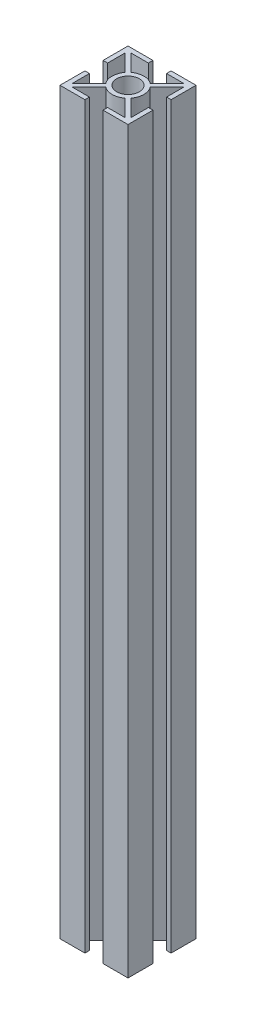
from build123d import *

# Parameters (mm, degrees)
SKETCH1_R               = 5
BOSS_EXTRUDE1_DEPTH     = 326
CUT_EXTRUDE1_REACH      = 329.721
CUT_EXTRUDE1_END_RADIUS = 5
SKETCH2_R               = 3.3234375


with BuildPart() as part:
    # Sketch1 → Boss-Extrude1 (new body)
    with BuildSketch(Plane(origin=(0, 0, 0), x_dir=(1, 0, 0), z_dir=(0, 1, 0))):
        with BuildLine():
            Line((4.191872704, 5.606086267), (11.5870568, 13.001270363))
            Line((11.5870568, 13.001270363), (4.001270363, 13.001270363))
            Line((4.001270363, 13.001270363), (4.001270363, 15.001270363))
            Line((4.001270363, 15.001270363), (15.001270363, 15.001270363))
            Line((15.001270363, 15.001270363), (15.001270363, 4.001270363))
            Line((15.001270363, 4.001270363), (13.001270363, 4.001270363))
            Line((13.001270363, 4.001270363), (13.001270363, 11.5870568))
            Line((13.001270363, 11.5870568), (5.606086267, 4.191872704))
            ThreePointArc((5.606086267, 4.191872704), (7, 0), (5.606086267, -4.191872704))
            Line((5.606086267, -4.191872704), (13.001270363, -11.5870568))
            Line((13.001270363, -11.5870568), (13.001270363, -4.001270363))
            Line((13.001270363, -4.001270363), (15.001270363, -4.001270363))
            Line((15.001270363, -4.001270363), (15.001270363, -15.001270363))
            Line((15.001270363, -15.001270363), (4.001270363, -15.001270363))
            Line((4.001270363, -15.001270363), (4.001270363, -13.001270363))
            Line((4.001270363, -13.001270363), (11.5870568, -13.001270363))
            Line((11.5870568, -13.001270363), (4.191872704, -5.606086267))
            ThreePointArc((4.191872704, -5.606086267), (0, -7), (-4.191872704, -5.606086267))
            Line((-4.191872704, -5.606086267), (-11.5870568, -13.001270363))
            Line((-11.5870568, -13.001270363), (-4.001270363, -13.001270363))
            Line((-4.001270363, -13.001270363), (-4.001270363, -15.001270363))
            Line((-4.001270363, -15.001270363), (-15.001270363, -15.001270363))
            Line((-15.001270363, -15.001270363), (-15.001270363, -4.001270363))
            Line((-15.001270363, -4.001270363), (-13.001270363, -4.001270363))
            Line((-13.001270363, -4.001270363), (-13.001270363, -11.5870568))
            Line((-13.001270363, -11.5870568), (-5.606086267, -4.191872704))
            ThreePointArc((-5.606086267, -4.191872704), (-7, 0), (-5.606086267, 4.191872704))
            Line((-5.606086267, 4.191872704), (-13.001270363, 11.5870568))
            Line((-13.001270363, 11.5870568), (-13.001270363, 4.001270363))
            Line((-13.001270363, 4.001270363), (-15.001270363, 4.001270363))
            Line((-15.001270363, 4.001270363), (-15.001270363, 15.001270363))
            Line((-15.001270363, 15.001270363), (-4.001270363, 15.001270363))
            Line((-4.001270363, 15.001270363), (-4.001270363, 13.001270363))
            Line((-4.001270363, 13.001270363), (-11.5870568, 13.001270363))
            Line((-11.5870568, 13.001270363), (-4.191872704, 5.606086267))
            ThreePointArc((-4.191872704, 5.606086267), (0, 7), (4.191872704, 5.606086267))
        make_face()
        with Locations(Location((0, 0, 0), (0, 0, 270))):
            Circle(SKETCH1_R, mode=Mode.SUBTRACT)
    extrude(amount=BOSS_EXTRUDE1_DEPTH)

    # Cut-Extrude1: up to this cylinder (the profile starts outside it)
    cut_extrude1_end = Plane(origin=(0, 82, 0), z_dir=(0, -1, 0)) * Cylinder(CUT_EXTRUDE1_END_RADIUS, 670.442, mode=Mode.PRIVATE)
    # Sketch2 → Cut-Extrude1 (cut, up to the surface)
    with BuildSketch(Plane.XY.offset(15.001270363), mode=Mode.PRIVATE) as cut_extrude1_sk1:
        with Locations((-0.001270363, 82)):
            Circle(SKETCH2_R)
    cut_extrude1_tool1 = extrude(cut_extrude1_sk1.sketch, amount=-CUT_EXTRUDE1_REACH, mode=Mode.PRIVATE) - cut_extrude1_end
    add(cut_extrude1_tool1.solids().sort_by_distance((-0.00127, 82, 15.00127))[0], mode=Mode.SUBTRACT)


solid = part.part
